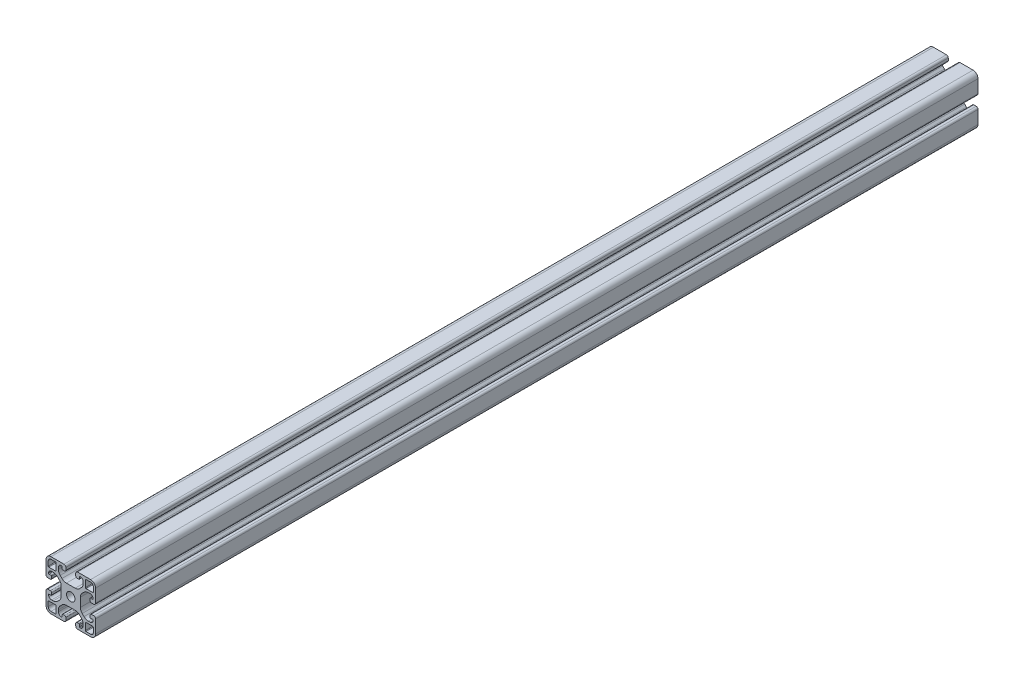
from build123d import *

# Parameters (mm, degrees)
ESQUISSE1_R        = 3.4
BOSS_EXTRU_1_DEPTH = 712


with BuildPart() as part:
    # Esquisse1 → Boss.-Extru.1 (new body)
    with BuildSketch(Plane(origin=(0, 0, -30), x_dir=(-1, 0, 0), z_dir=(0, 0, -1))):
        with BuildLine():
            Line((-4.5, 15), (-4.5, 13.5))
            ThreePointArc((-4.5, 13.5), (-4.353553391, 13.146446609), (-4, 13))
            Line((-4, 13), (-2.5, 13))
            ThreePointArc((-2.5, 13), (-2.146446609, 12.853553391), (-2, 12.5))
            ThreePointArc((-2, 12.5), (-2.732233047, 10.732233047), (-4.5, 10))
            Line((-4.5, 10), (-5.807611845, 10))
            ThreePointArc((-5.807611845, 10), (-7.721029006, 10.380602337), (-9.343145751, 11.464466094))
            Line((-9.343145751, 11.464466094), (-10.785533906, 12.906854249))
            ThreePointArc((-10.785533906, 12.906854249), (-11.869397663, 14.528970994), (-12.25, 16.442388155))
            Line((-12.25, 16.442388155), (-12.25, 23.557611845))
            ThreePointArc((-12.25, 23.557611845), (-11.869397663, 25.471029006), (-10.785533906, 27.093145751))
            Line((-10.785533906, 27.093145751), (-9.343145751, 28.535533906))
            ThreePointArc((-9.343145751, 28.535533906), (-7.721029006, 29.619397663), (-5.807611845, 30))
            Line((-5.807611845, 30), (-4.5, 30))
            ThreePointArc((-4.5, 30), (-2.732233047, 29.267766953), (-2, 27.5))
            ThreePointArc((-2, 27.5), (-2.146446609, 27.146446609), (-2.5, 27))
            Line((-2.5, 27), (-4, 27))
            ThreePointArc((-4, 27), (-4.353553391, 26.853553391), (-4.5, 26.5))
            Line((-4.5, 26.5), (-4.5, 25))
            ThreePointArc((-4.5, 25), (-4.207106781, 24.292893219), (-3.5, 24))
            Line((-3.5, 24), (-1.5, 24))
            ThreePointArc((-1.5, 24), (-0.439339828, 24.439339828), (0, 25.5))
            Line((0, 25.5), (0, 36))
            ThreePointArc((0, 36), (-1.171572875, 38.828427125), (-4, 40))
            Line((-4, 40), (-14.5, 40))
            ThreePointArc((-14.5, 40), (-15.560660172, 39.560660172), (-16, 38.5))
            Line((-16, 38.5), (-16, 36.5))
            ThreePointArc((-16, 36.5), (-15.707106781, 35.792893219), (-15, 35.5))
            Line((-15, 35.5), (-13.5, 35.5))
            ThreePointArc((-13.5, 35.5), (-13.146446609, 35.646446609), (-13, 36))
            Line((-13, 36), (-13, 37.5))
            ThreePointArc((-13, 37.5), (-12.853553391, 37.853553391), (-12.5, 38))
            ThreePointArc((-12.5, 38), (-10.732233047, 37.267766953), (-10, 35.5))
            Line((-10, 35.5), (-10, 34.192388155))
            ThreePointArc((-10, 34.192388155), (-10.380602337, 32.278970994), (-11.464466094, 30.656854249))
            Line((-11.464466094, 30.656854249), (-12.906854249, 29.214466094))
            ThreePointArc((-12.906854249, 29.214466094), (-14.528970994, 28.130602337), (-16.442388155, 27.75))
            Line((-16.442388155, 27.75), (-23.557611845, 27.75))
            ThreePointArc((-23.557611845, 27.75), (-25.471029006, 28.130602337), (-27.093145751, 29.214466094))
            Line((-27.093145751, 29.214466094), (-28.535533906, 30.656854249))
            ThreePointArc((-28.535533906, 30.656854249), (-29.619397663, 32.278970994), (-30, 34.192388155))
            Line((-30, 34.192388155), (-30, 35.5))
            ThreePointArc((-30, 35.5), (-29.267766953, 37.267766953), (-27.5, 38))
            ThreePointArc((-27.5, 38), (-27.146446609, 37.853553391), (-27, 37.5))
            Line((-27, 37.5), (-27, 36))
            ThreePointArc((-27, 36), (-26.853553391, 35.646446609), (-26.5, 35.5))
            Line((-26.5, 35.5), (-25, 35.5))
            ThreePointArc((-25, 35.5), (-24.292893219, 35.792893219), (-24, 36.5))
            Line((-24, 36.5), (-24, 38.5))
            ThreePointArc((-24, 38.5), (-24.439339828, 39.560660172), (-25.5, 40))
            Line((-25.5, 40), (-36, 40))
            ThreePointArc((-36, 40), (-38.828427125, 38.828427125), (-40, 36))
            Line((-40, 36), (-40, 25.5))
            ThreePointArc((-40, 25.5), (-39.560660172, 24.439339828), (-38.5, 24))
            Line((-38.5, 24), (-36.5, 24))
            ThreePointArc((-36.5, 24), (-35.792893219, 24.292893219), (-35.5, 25))
            Line((-35.5, 25), (-35.5, 26.5))
            ThreePointArc((-35.5, 26.5), (-35.646446609, 26.853553391), (-36, 27))
            Line((-36, 27), (-37.5, 27))
            ThreePointArc((-37.5, 27), (-37.853553391, 27.146446609), (-38, 27.5))
            ThreePointArc((-38, 27.5), (-37.267766953, 29.267766953), (-35.5, 30))
            Line((-35.5, 30), (-34.192388155, 30))
            ThreePointArc((-34.192388155, 30), (-32.278970994, 29.619397663), (-30.656854249, 28.535533906))
            Line((-30.656854249, 28.535533906), (-29.214466094, 27.093145751))
            ThreePointArc((-29.214466094, 27.093145751), (-28.130602337, 25.471029006), (-27.75, 23.557611845))
            Line((-27.75, 23.557611845), (-27.75, 16.442388155))
            ThreePointArc((-27.75, 16.442388155), (-28.130602337, 14.528970994), (-29.214466094, 12.906854249))
            Line((-29.214466094, 12.906854249), (-30.656854249, 11.464466094))
            ThreePointArc((-30.656854249, 11.464466094), (-32.278970994, 10.380602337), (-34.192388155, 10))
            Line((-34.192388155, 10), (-35.5, 10))
            ThreePointArc((-35.5, 10), (-37.267766953, 10.732233047), (-38, 12.5))
            ThreePointArc((-38, 12.5), (-37.853553391, 12.853553391), (-37.5, 13))
            Line((-37.5, 13), (-36, 13))
            ThreePointArc((-36, 13), (-35.646446609, 13.146446609), (-35.5, 13.5))
            Line((-35.5, 13.5), (-35.5, 15))
            ThreePointArc((-35.5, 15), (-35.792893219, 15.707106781), (-36.5, 16))
            Line((-36.5, 16), (-38.5, 16))
            ThreePointArc((-38.5, 16), (-39.560660172, 15.560660172), (-40, 14.5))
            Line((-40, 14.5), (-40, 4))
            ThreePointArc((-40, 4), (-38.828427125, 1.171572875), (-36, 0))
            Line((-36, 0), (-25.5, 0))
            ThreePointArc((-25.5, 0), (-24.439339828, 0.439339828), (-24, 1.5))
            Line((-24, 1.5), (-24, 3.5))
            ThreePointArc((-24, 3.5), (-24.292893219, 4.207106781), (-25, 4.5))
            Line((-25, 4.5), (-26.5, 4.5))
            ThreePointArc((-26.5, 4.5), (-26.853553391, 4.353553391), (-27, 4))
            Line((-27, 4), (-27, 2.5))
            ThreePointArc((-27, 2.5), (-27.146446609, 2.146446609), (-27.5, 2))
            ThreePointArc((-27.5, 2), (-29.267766953, 2.732233047), (-30, 4.5))
            Line((-30, 4.5), (-30, 5.807611845))
            ThreePointArc((-30, 5.807611845), (-29.619397663, 7.721029006), (-28.535533906, 9.343145751))
            Line((-28.535533906, 9.343145751), (-27.093145751, 10.785533906))
            ThreePointArc((-27.093145751, 10.785533906), (-25.471029006, 11.869397663), (-23.557611845, 12.25))
            Line((-23.557611845, 12.25), (-16.442388155, 12.25))
            ThreePointArc((-16.442388155, 12.25), (-14.528970994, 11.869397663), (-12.906854249, 10.785533906))
            Line((-12.906854249, 10.785533906), (-11.464466094, 9.343145751))
            ThreePointArc((-11.464466094, 9.343145751), (-10.380602337, 7.721029006), (-10, 5.807611845))
            Line((-10, 5.807611845), (-10, 4.5))
            ThreePointArc((-10, 4.5), (-10.732233047, 2.732233047), (-12.5, 2))
            ThreePointArc((-12.5, 2), (-12.853553391, 2.146446609), (-13, 2.5))
            Line((-13, 2.5), (-13, 4))
            ThreePointArc((-13, 4), (-13.146446609, 4.353553391), (-13.5, 4.5))
            Line((-13.5, 4.5), (-15, 4.5))
            ThreePointArc((-15, 4.5), (-15.707106781, 4.207106781), (-16, 3.5))
            Line((-16, 3.5), (-16, 1.5))
            ThreePointArc((-16, 1.5), (-15.560660172, 0.439339828), (-14.5, 0))
            Line((-14.5, 0), (-4, 0))
            ThreePointArc((-4, 0), (-1.171572875, 1.171572875), (0, 4))
            Line((0, 4), (0, 14.5))
            ThreePointArc((0, 14.5), (-0.439339828, 15.560660172), (-1.5, 16))
            Line((-1.5, 16), (-3.5, 16))
            ThreePointArc((-3.5, 16), (-4.207106781, 15.707106781), (-4.5, 15))
        make_face()
        with Locations(Location((-20, 20, 0), (0, 0, 180))):
            Circle(ESQUISSE1_R, mode=Mode.SUBTRACT)
        with BuildLine():
            Line((-4, 1.8), (-7.7, 1.8))
            ThreePointArc((-7.7, 1.8), (-8.053553391, 1.946446609), (-8.2, 2.3))
            Line((-8.2, 2.3), (-8.2, 7.7))
            ThreePointArc((-8.2, 7.7), (-8.053553391, 8.053553391), (-7.7, 8.2))
            Line((-7.7, 8.2), (-2.3, 8.2))
            ThreePointArc((-2.3, 8.2), (-1.946446609, 8.053553391), (-1.8, 7.7))
            Line((-1.8, 7.7), (-1.8, 4))
            ThreePointArc((-1.8, 4), (-2.444365081, 2.444365081), (-4, 1.8))
        make_face(mode=Mode.SUBTRACT)
        with BuildLine():
            Line((-38.2, 4), (-38.2, 7.7))
            ThreePointArc((-38.2, 7.7), (-38.053553391, 8.053553391), (-37.7, 8.2))
            Line((-37.7, 8.2), (-32.3, 8.2))
            ThreePointArc((-32.3, 8.2), (-31.946446609, 8.053553391), (-31.8, 7.7))
            Line((-31.8, 7.7), (-31.8, 2.3))
            ThreePointArc((-31.8, 2.3), (-31.946446609, 1.946446609), (-32.3, 1.8))
            Line((-32.3, 1.8), (-36, 1.8))
            ThreePointArc((-36, 1.8), (-37.555634919, 2.444365081), (-38.2, 4))
        make_face(mode=Mode.SUBTRACT)
        with BuildLine():
            Line((-36, 38.2), (-32.3, 38.2))
            ThreePointArc((-32.3, 38.2), (-31.946446609, 38.053553391), (-31.8, 37.7))
            Line((-31.8, 37.7), (-31.8, 32.3))
            ThreePointArc((-31.8, 32.3), (-31.946446609, 31.946446609), (-32.3, 31.8))
            Line((-32.3, 31.8), (-37.7, 31.8))
            ThreePointArc((-37.7, 31.8), (-38.053553391, 31.946446609), (-38.2, 32.3))
            Line((-38.2, 32.3), (-38.2, 36))
            ThreePointArc((-38.2, 36), (-37.555634919, 37.555634919), (-36, 38.2))
        make_face(mode=Mode.SUBTRACT)
        with BuildLine():
            Line((-1.8, 36), (-1.8, 32.3))
            ThreePointArc((-1.8, 32.3), (-1.946446609, 31.946446609), (-2.3, 31.8))
            Line((-2.3, 31.8), (-7.7, 31.8))
            ThreePointArc((-7.7, 31.8), (-8.053553391, 31.946446609), (-8.2, 32.3))
            Line((-8.2, 32.3), (-8.2, 37.7))
            ThreePointArc((-8.2, 37.7), (-8.053553391, 38.053553391), (-7.7, 38.2))
            Line((-7.7, 38.2), (-4, 38.2))
            ThreePointArc((-4, 38.2), (-2.444365081, 37.555634919), (-1.8, 36))
        make_face(mode=Mode.SUBTRACT)
    extrude(amount=-BOSS_EXTRU_1_DEPTH)


solid = part.part
